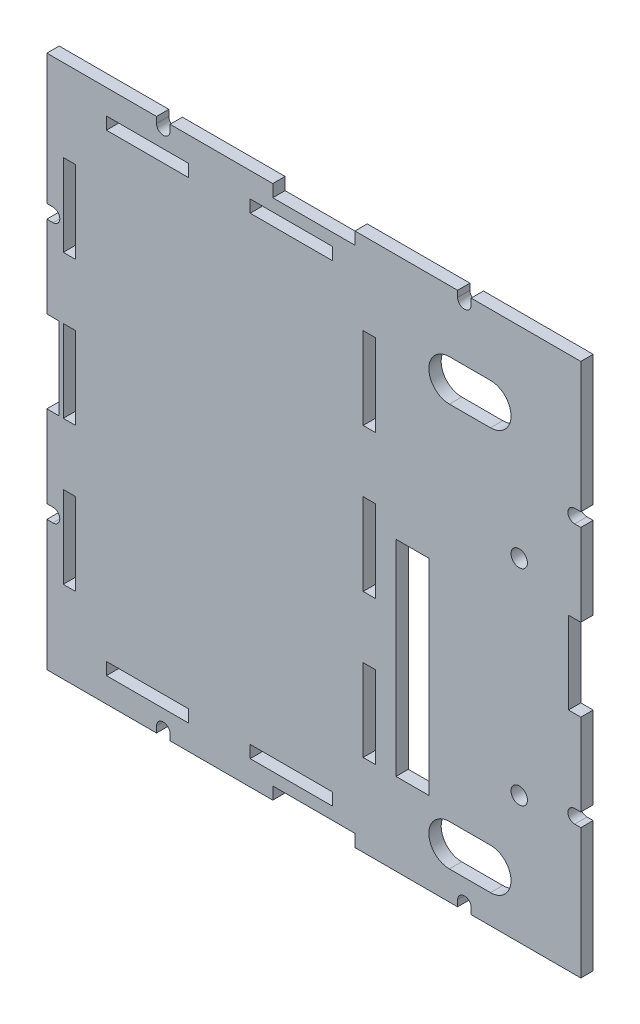
from build123d import *

# Parameters (mm, degrees)
SKETCH1_W           = 20
SKETCH1_H           = 3
SKETCH1_W_2         = 3
SKETCH1_H_2         = 20
SKETCH1_W_3         = 8
SKETCH1_H_3         = 50
SKETCH1_R           = 2
BOSS_EXTRUDE1_DEPTH = 3


with BuildPart() as part:
    # Sketch1 → Boss-Extrude1 (new body)
    with BuildSketch(Plane.XY):
        with BuildLine():
            Line((10, -62), (10, -65))
            Line((10, -65), (35, -65))
            Line((35, -65), (35, -63.5))
            ThreePointArc((35, -63.5), (36.65, -61.85), (38.3, -63.5))
            Line((38.3, -63.5), (38.3, -65))
            Line((38.3, -65), (65, -65))
            Line((65, -65), (65, -33.3))
            Line((65, -33.3), (63.5, -33.3))
            ThreePointArc((63.5, -33.3), (61.85, -31.65), (63.5, -30))
            Line((63.5, -30), (65, -30))
            Line((65, -30), (65, -10))
            Line((65, -10), (62, -10))
            Line((62, -10), (62, 10))
            Line((62, 10), (65, 10))
            Line((65, 10), (65, 30))
            Line((65, 30), (63.5, 30))
            ThreePointArc((63.5, 30), (61.85, 31.65), (63.5, 33.3))
            Line((63.5, 33.3), (65, 33.3))
            Line((65, 33.3), (65, 65))
            Line((65, 65), (38.3, 65))
            Line((38.3, 65), (38.3, 63.5))
            ThreePointArc((38.3, 63.5), (36.65, 61.85), (35, 63.5))
            Line((35, 63.5), (35, 65))
            Line((35, 65), (10, 65))
            Line((10, 65), (10, 62))
            Line((10, 62), (-10, 62))
            Line((-10, 62), (-10, 65))
            Line((-10, 65), (-35, 65))
            Line((-35, 65), (-35, 63.5))
            ThreePointArc((-35, 63.5), (-36.65, 61.85), (-38.3, 63.5))
            Line((-38.3, 63.5), (-38.3, 65))
            Line((-38.3, 65), (-65, 65))
            Line((-65, 65), (-65, 33.3))
            Line((-65, 33.3), (-63.5, 33.3))
            ThreePointArc((-63.5, 33.3), (-61.85, 31.65), (-63.5, 30))
            Line((-63.5, 30), (-65, 30))
            Line((-65, 30), (-65, 10))
            Line((-65, 10), (-62, 10))
            Line((-62, 10), (-62, -10))
            Line((-62, -10), (-65, -10))
            Line((-65, -10), (-65, -30))
            Line((-65, -30), (-63.5, -30))
            ThreePointArc((-63.5, -30), (-61.85, -31.65), (-63.5, -33.3))
            Line((-63.5, -33.3), (-65, -33.3))
            Line((-65, -33.3), (-65, -65))
            Line((-65, -65), (-38.3, -65))
            Line((-38.3, -65), (-38.3, -63.5))
            ThreePointArc((-38.3, -63.5), (-36.65, -61.85), (-35, -63.5))
            Line((-35, -63.5), (-35, -65))
            Line((-35, -65), (-10, -65))
            Line((-10, -65), (-10, -62))
            Line((-10, -62), (10, -62))
        make_face()
        with Locations((-40.5, -57.5)):
            Rectangle(SKETCH1_W, SKETCH1_H, mode=Mode.SUBTRACT)
        with Locations((-59.5, -35)):
            Rectangle(SKETCH1_W_2, SKETCH1_H_2, mode=Mode.SUBTRACT)
        with Locations((-5.5, -57.5)):
            Rectangle(SKETCH1_W, SKETCH1_H, mode=Mode.SUBTRACT)
        with Locations((13.5, -35)):
            Rectangle(SKETCH1_W_2, SKETCH1_H_2, mode=Mode.SUBTRACT)
        with BuildLine():
            Line((33, -48), (43, -48))
            ThreePointArc((43, -48), (48, -53), (43, -58))
            Line((43, -58), (33, -58))
            ThreePointArc((33, -58), (28, -53), (33, -48))
        make_face(mode=Mode.SUBTRACT)
        with Locations((24, -20)):
            Rectangle(SKETCH1_W_3, SKETCH1_H_3, mode=Mode.SUBTRACT)
        with Locations((50, -34)):
            Circle(SKETCH1_R, mode=Mode.SUBTRACT)
        with Locations((-59.5, 0)):
            Rectangle(SKETCH1_W_2, SKETCH1_H_2, mode=Mode.SUBTRACT)
        with Locations((-59.5, 35)):
            Rectangle(SKETCH1_W_2, SKETCH1_H_2, mode=Mode.SUBTRACT)
        with Locations((-40.5, 57.5)):
            Rectangle(SKETCH1_W, SKETCH1_H, mode=Mode.SUBTRACT)
        with Locations((-5.5, 57.5)):
            Rectangle(SKETCH1_W, SKETCH1_H, mode=Mode.SUBTRACT)
        with Locations((13.5, 0)):
            Rectangle(SKETCH1_W_2, SKETCH1_H_2, mode=Mode.SUBTRACT)
        with Locations((50, 16)):
            Circle(SKETCH1_R, mode=Mode.SUBTRACT)
        with Locations((13.5, 35)):
            Rectangle(SKETCH1_W_2, SKETCH1_H_2, mode=Mode.SUBTRACT)
        with BuildLine():
            ThreePointArc((43, 50), (48, 45), (43, 40))
            Line((43, 40), (33, 40))
            ThreePointArc((33, 40), (28, 45), (33, 50))
            Line((33, 50), (43, 50))
        make_face(mode=Mode.SUBTRACT)
    extrude(amount=BOSS_EXTRUDE1_DEPTH)


solid = part.part
